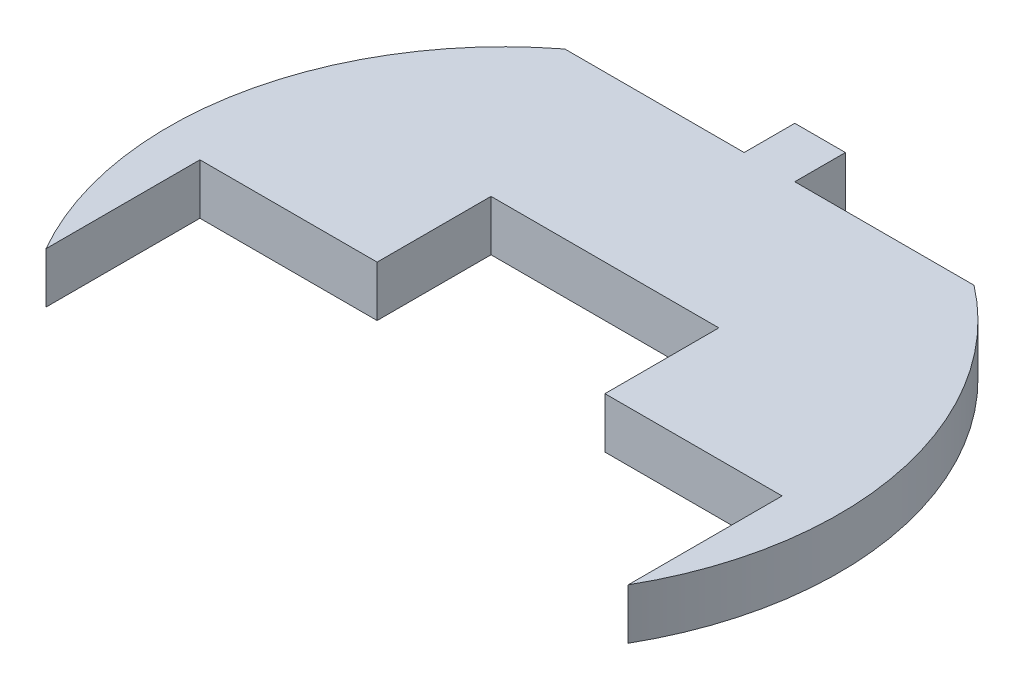
from build123d import *

# Parameters (mm, degrees)
SCHIZZO1_W                   = 4
SCHIZZO1_H                   = 4
ESTRUSIONE_ESTRUSIONE1_DEPTH = 4


with BuildPart() as part:
    # Schizzo1 → Estrusione-Estrusione1 (new body)
    with BuildSketch(Plane(origin=(0, 0, 0), x_dir=(1, 0, 0), z_dir=(0, 1, 0))):
        with BuildLine():
            Line((-2, 16), (-16.163229875, 16))
            ThreePointArc((-16.163229875, 16), (-25.984761547, 0.200208393), (-23, -18.162446581))
            Line((-23, -18.162446581), (-23, -6))
            Line((-23, -6), (-9, -6))
            Line((-9, -6), (-9, 3))
            Line((-9, 3), (9, 3))
            Line((9, 3), (9, -6))
            Line((9, -6), (23, -6))
            Line((23, -6), (23, -18.162446581))
            ThreePointArc((23, -18.162446581), (25.984761547, 0.200208393), (16.163229875, 16))
            Line((16.163229875, 16), (2, 16))
            Line((2, 16), (-2, 16))
        make_face()
        with Locations((0, 18)):
            Rectangle(SCHIZZO1_W, SCHIZZO1_H)
    extrude(amount=ESTRUSIONE_ESTRUSIONE1_DEPTH)


solid = part.part
